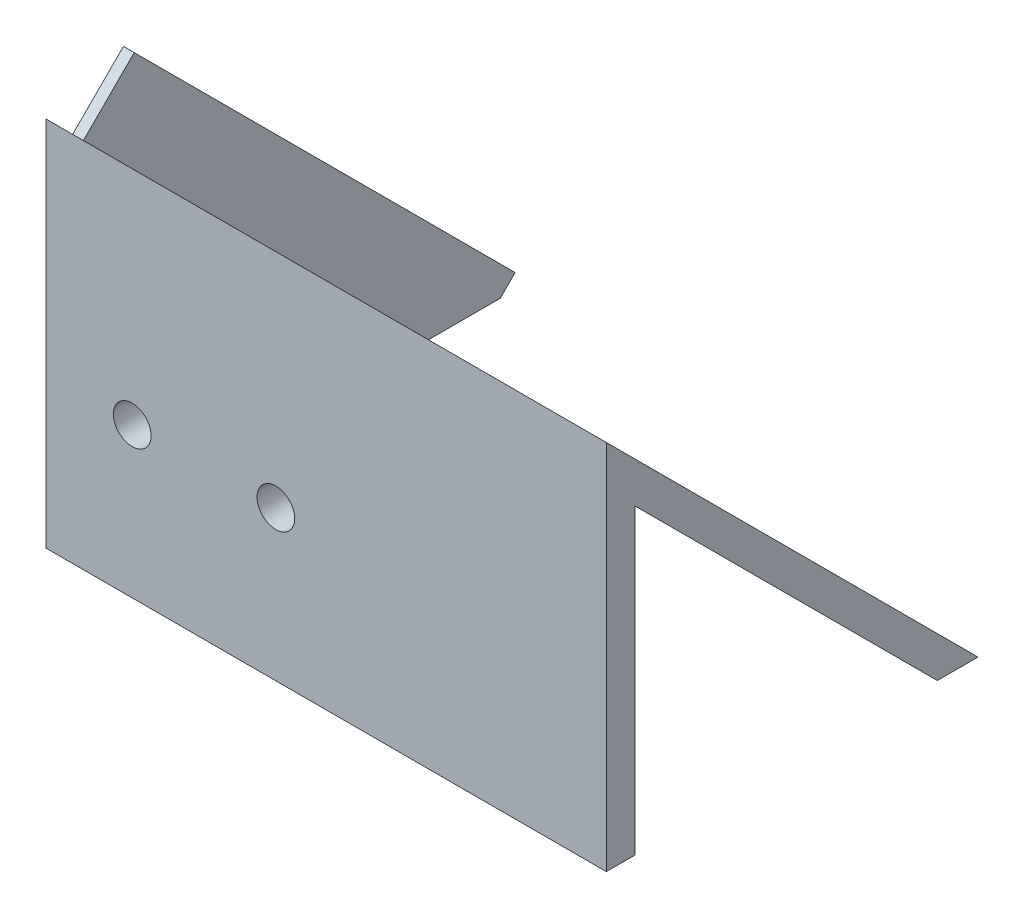
from build123d import *

# Parameters (mm, degrees)
BOSS_EXTRUDE1_DEPTH = 78
SKETCH2_W           = 1.5
SKETCH2_H           = 75
BOSS_EXTRUDE2_DEPTH = 10
CUT_EXTRUDE1_REACH  = 119.339
SKETCH4_R           = 2.625
SKETCH5_W           = 78
SKETCH5_H           = 5
CUT_EXTRUDE2_DEPTH  = 118.338622692


with BuildPart() as part:
    # Sketch1 → Boss-Extrude1 (new body)
    with BuildSketch(Plane(origin=(0, 0, 0), x_dir=(0, 0, -1), z_dir=(1, 0, 0))):
        Polygon((0, 0), (0, 56.74), (56.74, 0), (51.08, 0), (4, 47.08), (4, 0), align=None)
    extrude(amount=BOSS_EXTRUDE1_DEPTH)

    # Sketch2 → Boss-Extrude2 (add)
    with BuildSketch(Plane(origin=(0, 28.37, -28.37), x_dir=(1, 0, 0), z_dir=(0, 0.7071067811865482, -0.7071067811865468))):
        with Locations((0.75, 2.621238765)):
            Rectangle(SKETCH2_W, SKETCH2_H)
    extrude(amount=BOSS_EXTRUDE2_DEPTH)

    # Sketch4 → Cut-Extrude1 (cut, up to next)
    with BuildSketch(Plane.XY, mode=Mode.PRIVATE) as cut_extrude1_sk1:
        with Locations((12, 25.86)):
            Circle(SKETCH4_R)
    cut_extrude1_tool1 = extrude(cut_extrude1_sk1.sketch, amount=-CUT_EXTRUDE1_REACH, mode=Mode.PRIVATE) & part.part
    # Sketch4 → Cut-Extrude1 (cut, up to next)
    with BuildSketch(Plane.XY, mode=Mode.PRIVATE) as cut_extrude1_sk2:
        with Locations((32, 25.86)):
            Circle(SKETCH4_R)
    cut_extrude1_tool2 = extrude(cut_extrude1_sk2.sketch, amount=-CUT_EXTRUDE1_REACH, mode=Mode.PRIVATE) & part.part
    add(cut_extrude1_tool1.solids().sort_by_distance((12, 25.86, 0))[0], mode=Mode.SUBTRACT)
    add(cut_extrude1_tool2.solids().sort_by_distance((32, 25.86, 0))[0], mode=Mode.SUBTRACT)

    # Sketch5 → Cut-Extrude2 (cut, through all)
    with BuildSketch(Plane.XY):
        with Locations((39, 2.5)):
            Rectangle(SKETCH5_W, SKETCH5_H)
    extrude(amount=-CUT_EXTRUDE2_DEPTH, mode=Mode.SUBTRACT)


solid = part.part
